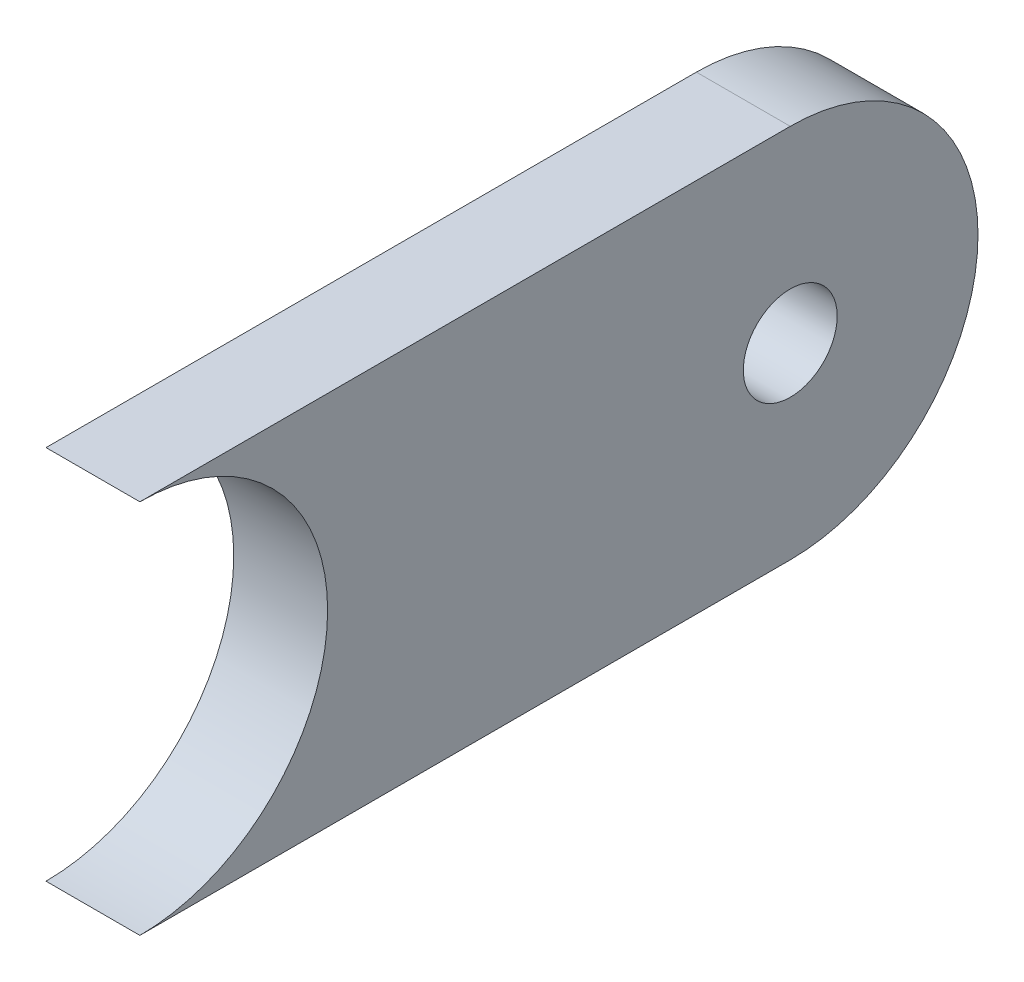
from build123d import *

# Parameters (mm, degrees)
SKETCH_1_R      = 2.5
EXTRUDE_1_DEPTH = 5


with BuildPart() as part:
    # 草圖1 → 填料-伸長1 (new body)
    with BuildSketch(Plane(origin=(0, 0, 0), x_dir=(0, 0, -1), z_dir=(1, 0, 0))):
        with BuildLine():
            Line((-34.64, -10), (0, -10))
            ThreePointArc((0, -10), (10, 0), (0, 10))
            Line((0, 10), (-34.64, 10))
            ThreePointArc((-34.64, 10), (-24.64, 0), (-34.64, -10))
        make_face()
        Circle(SKETCH_1_R, mode=Mode.SUBTRACT)
    extrude(amount=EXTRUDE_1_DEPTH)


solid = part.part
